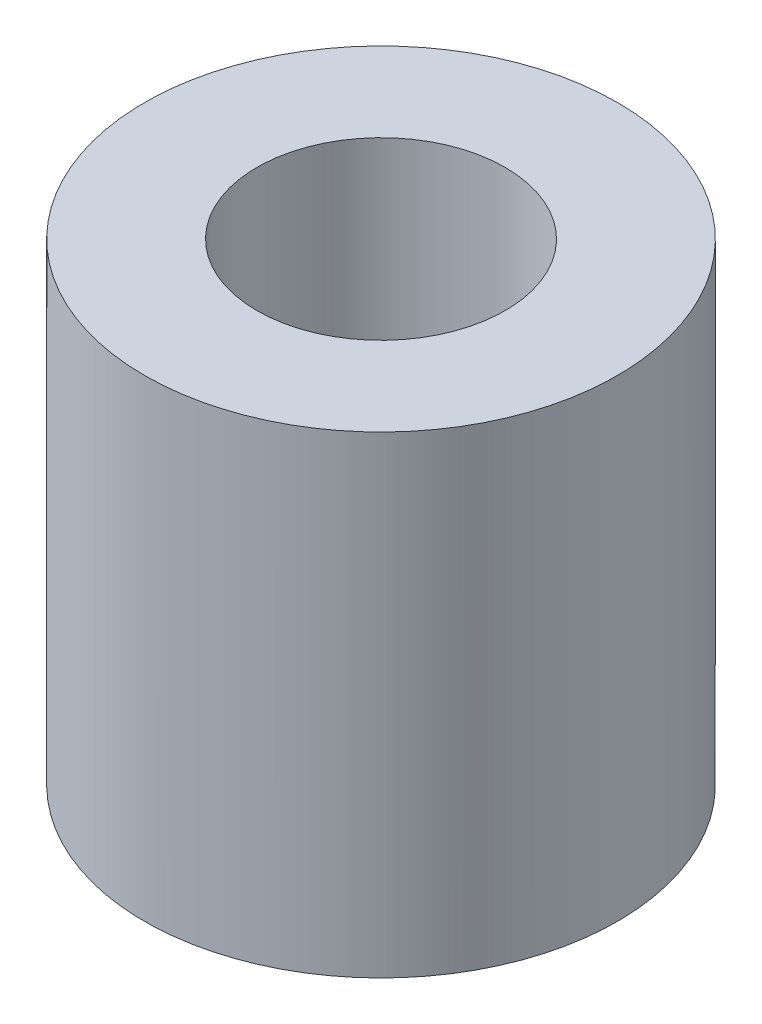
from build123d import *

# Parameters (mm, degrees)
SKETCH1_R           = 7.62
SKETCH1_R_2         = 4.0005
BOSS_EXTRUDE1_DEPTH = 12.7
BOSS_EXTRUDE2_START = 2.54
SKETCH2_R           = 7.62
BOSS_EXTRUDE2_DEPTH = 2.54


with BuildPart() as part:
    # Sketch1 → Boss-Extrude1 (new body)
    with BuildSketch(Plane(origin=(0, 0, 0), x_dir=(1, 0, 0), z_dir=(0, 1, 0))):
        with Locations(Location((0, 0, 0), (0, 0, 270))):
            Circle(SKETCH1_R)
        with Locations(Location((0, 0, 0), (0, 0, 270))):
            Circle(SKETCH1_R_2, mode=Mode.SUBTRACT)
    extrude(amount=BOSS_EXTRUDE1_DEPTH)

    # Sketch2 → Boss-Extrude2 (add)
    with BuildSketch(Plane.XZ.offset(BOSS_EXTRUDE2_START)):
        with Locations(Location((0, 0, 0), (0, 0, 270))):
            Circle(SKETCH2_R)
    extrude(amount=-BOSS_EXTRUDE2_DEPTH)


solid = part.part
